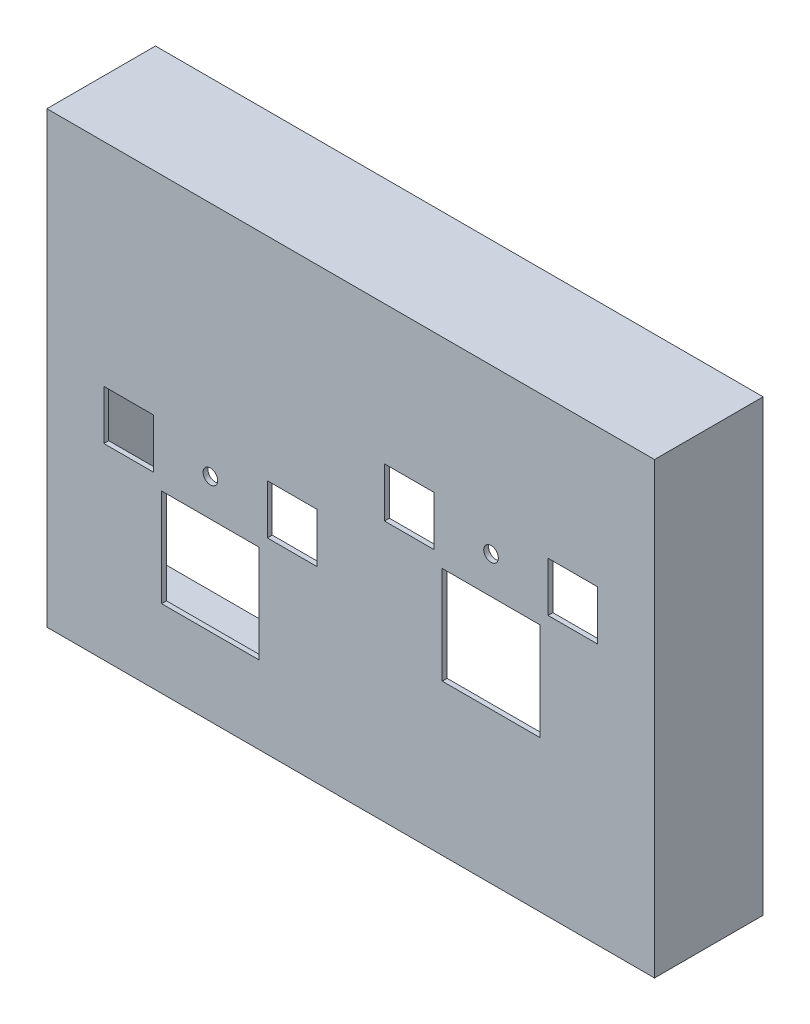
from build123d import *

# Parameters (mm, degrees)
CROQUIS1_W              = 249
CROQUIS1_H              = 84
SALIENTE_EXTRUIR1_DEPTH = 44.5
VACIADO1_T              = -2
CROQUIS2_W              = 20.3
CROQUIS2_H              = 20.3
CORTAR_EXTRUIR1_DEPTH   = 45
CROQUIS4_R              = 3
CORTAR_EXTRUIR2_DEPTH   = 10
CROQUIS5_W              = 249
CROQUIS5_H              = 40
CROQUIS5_H_2            = 60
SALIENTE_EXTRUIR3_DEPTH = 44.5
CROQUIS7_W              = 245
CROQUIS7_H              = 40.5
CORTAR_EXTRUIR3_DEPTH   = 180
CROQUIS8_W              = 245
CROQUIS8_H              = 180
CORTAR_EXTRUIR4_DEPTH   = 42.5
CROQUIS9_W              = 40
CROQUIS9_H              = 40
CORTAR_EXTRUIR5_DEPTH   = 2


with BuildPart() as part:
    # Croquis1 → Saliente-Extruir1 (new body)
    with BuildSketch(Plane.XY):
        with Locations((124.5, 42)):
            Rectangle(CROQUIS1_W, CROQUIS1_H)
    extrude(amount=SALIENTE_EXTRUIR1_DEPTH)

    # Vaciado1
    vaciado1_openings = [part.faces().sort_by_distance(p)[0] for p in [
        (124.5, 42, 0),
    ]]
    offset(amount=VACIADO1_T, openings=vaciado1_openings, kind=Kind.INTERSECTION)

    # Croquis2 → Cortar-Extruir1 (cut)
    with BuildSketch(Plane(origin=(0, 0, 42.5), x_dir=(-1, 0, 0), z_dir=(0, 0, -1))):
        with Locations((-100.5, 27)):
            Rectangle(CROQUIS2_W, CROQUIS2_H)
        with Locations((-33.5, 27)):
            Rectangle(CROQUIS2_W, CROQUIS2_H)
        with Locations((-215.5, 57)):
            Rectangle(CROQUIS2_W, CROQUIS2_H)
        with Locations((-148.5, 57)):
            Rectangle(CROQUIS2_W, CROQUIS2_H)
    extrude(amount=-CORTAR_EXTRUIR1_DEPTH, mode=Mode.SUBTRACT)

    # Croquis4 → Cortar-Extruir2 (cut)
    with BuildSketch(Plane.XY.offset(44.5)):
        with Locations((67, 27)):
            Circle(CROQUIS4_R)
        with Locations((182, 57)):
            Circle(CROQUIS4_R)
    extrude(amount=-CORTAR_EXTRUIR2_DEPTH, mode=Mode.SUBTRACT)

    # Croquis5 → Saliente-Extruir3 (add)
    with BuildSketch(Plane.XY.offset(44.5)):
        with Locations((124.5, 104)):
            Rectangle(CROQUIS5_W, CROQUIS5_H)
        with Locations((124.5, -30)):
            Rectangle(CROQUIS5_W, CROQUIS5_H_2)
    extrude(amount=-SALIENTE_EXTRUIR3_DEPTH)

    # Croquis7 → Cortar-Extruir3 (cut)
    with BuildSketch(Plane(origin=(0, -58, 0), x_dir=(-1, 0, 0), z_dir=(0, -1, 0))):
        with Locations((-124.5, -22.25)):
            Rectangle(CROQUIS7_W, CROQUIS7_H)
    extrude(amount=-CORTAR_EXTRUIR3_DEPTH, mode=Mode.SUBTRACT)

    # Croquis8 → Cortar-Extruir4 (cut)
    with BuildSketch(Plane(origin=(0, 0, 0), x_dir=(-1, 0, 0), z_dir=(0, 0, -1))):
        with Locations((-124.5, 32)):
            Rectangle(CROQUIS8_W, CROQUIS8_H)
    extrude(amount=-CORTAR_EXTRUIR4_DEPTH, mode=Mode.SUBTRACT)

    # Croquis9 → Cortar-Extruir5 (cut)
    with BuildSketch(Plane.XY.offset(44.5)):
        with Locations((67, -8.15)):
            Rectangle(CROQUIS9_W, CROQUIS9_H)
        with Locations((182, 21.85)):
            Rectangle(CROQUIS9_W, CROQUIS9_H)
    extrude(amount=-CORTAR_EXTRUIR5_DEPTH, mode=Mode.SUBTRACT)


solid = part.part
